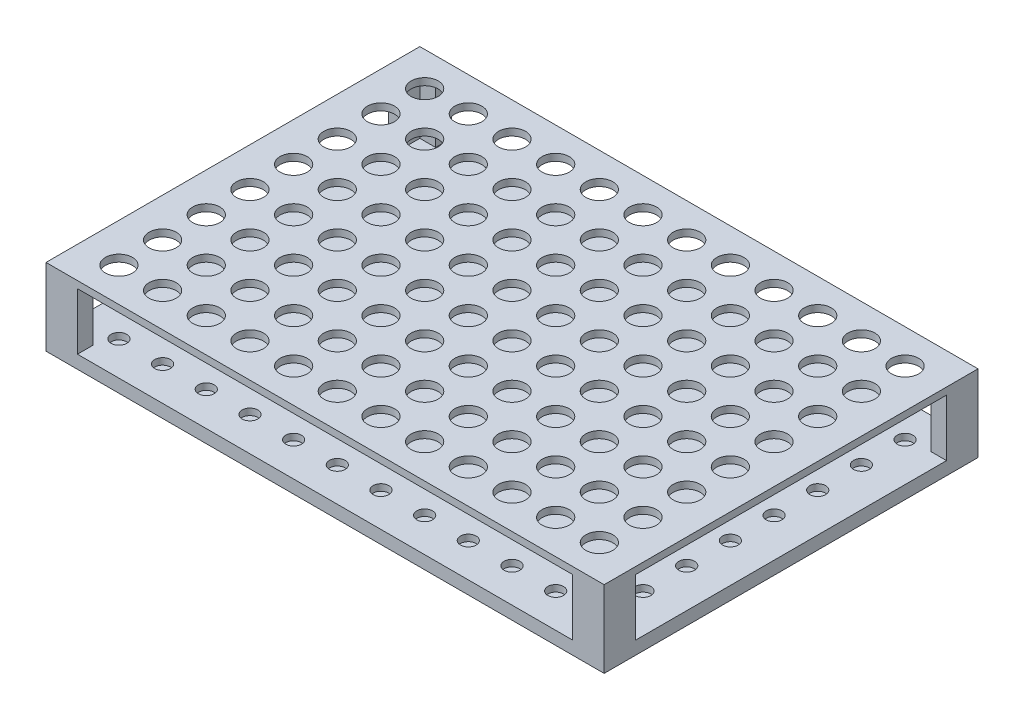
from build123d import *

# Parameters (mm, degrees)
SKETCH1_W           = 127.8
SKETCH1_H           = 85.6
BOSS_EXTRUDE1_DEPTH = 3
BOSS_EXTRUDE2_DEPTH = 13
SKETCH3_W           = 127.8
SKETCH3_H           = 85.6
BOSS_EXTRUDE3_DEPTH = 1.6
SKETCH6_R           = 3.1
CUT_EXTRUDE1_DEPTH  = 1.6
SKETCH8_R           = 1.8
CUT_EXTRUDE2_DEPTH  = 1.5


with BuildPart() as part:
    # Sketch1 → Boss-Extrude1 (new body)
    with BuildSketch(Plane(origin=(0, 0, 0), x_dir=(1, 0, 0), z_dir=(0, 1, 0))):
        Rectangle(SKETCH1_W, SKETCH1_H)
    extrude(amount=BOSS_EXTRUDE1_DEPTH)

    # Sketch2 → Boss-Extrude2 (add)
    with BuildSketch(Plane(origin=(0, 3, 0), x_dir=(1, 0, 0), z_dir=(0, 1, 0))):
        Polygon((-63.9, 42.8), (-56.7, 42.8), (-56.7, 39.2), (-60.3, 39.2), (-60.3, 35.6), (-63.9, 35.6), align=None)
        Polygon((63.9, 35.6), (63.9, 42.8), (56.7, 42.8), (56.7, 39.2), (60.3, 39.2), (60.3, 35.6), align=None)
        Polygon((63.9, -42.8), (56.7, -42.8), (56.7, -39.2), (60.3, -39.2), (60.3, -35.6), (63.9, -35.6), align=None)
        Polygon((-63.9, -35.6), (-63.9, -42.8), (-56.7, -42.8), (-56.7, -39.2), (-60.3, -39.2), (-60.3, -35.6), align=None)
    extrude(amount=BOSS_EXTRUDE2_DEPTH)

    # Sketch3 → Boss-Extrude3 (add)
    with BuildSketch(Plane(origin=(0, 16, 0), x_dir=(1, 0, 0), z_dir=(0, 1, 0))):
        Rectangle(SKETCH3_W, SKETCH3_H)
    extrude(amount=BOSS_EXTRUDE3_DEPTH)

    # Sketch6 → Cut-Extrude1 (cut)
    with BuildSketch(Plane(origin=(0, 17.6, 0), x_dir=(1, 0, 0), z_dir=(0, 1, 0))):
        with Locations(Location((-55, 35, 0), (0, 0, 270))):
            Circle(SKETCH6_R)
        with Locations(Location((-45, 35, 0), (0, 0, 270))):
            Circle(SKETCH6_R)
        with Locations(Location((-35, 35, 0), (0, 0, 270))):
            Circle(SKETCH6_R)
        with Locations(Location((-25, 35, 0), (0, 0, 270))):
            Circle(SKETCH6_R)
        with Locations(Location((-15, 35, 0), (0, 0, 270))):
            Circle(SKETCH6_R)
        with Locations(Location((-5, 35, 0), (0, 0, 270))):
            Circle(SKETCH6_R)
        with Locations(Location((5, 35, 0), (0, 0, 270))):
            Circle(SKETCH6_R)
        with Locations(Location((15, 35, 0), (0, 0, 270))):
            Circle(SKETCH6_R)
        with Locations(Location((25, 35, 0), (0, 0, 270))):
            Circle(SKETCH6_R)
        with Locations(Location((35, 35, 0), (0, 0, 270))):
            Circle(SKETCH6_R)
        with Locations(Location((45, 35, 0), (0, 0, 270))):
            Circle(SKETCH6_R)
        with Locations(Location((55, 35, 0), (0, 0, 270))):
            Circle(SKETCH6_R)
        with Locations(Location((-55, 25, 0), (0, 0, 270))):
            Circle(SKETCH6_R)
        with Locations(Location((-55, 15, 0), (0, 0, 270))):
            Circle(SKETCH6_R)
        with Locations(Location((-55, 5, 0), (0, 0, 270))):
            Circle(SKETCH6_R)
        with Locations(Location((-55, -5, 0), (0, 0, 270))):
            Circle(SKETCH6_R)
        with Locations(Location((-55, -15, 0), (0, 0, 270))):
            Circle(SKETCH6_R)
        with Locations(Location((-55, -25, 0), (0, 0, 270))):
            Circle(SKETCH6_R)
        with Locations(Location((-55, -35, 0), (0, 0, 270))):
            Circle(SKETCH6_R)
        with Locations(Location((-45, 25, 0), (0, 0, 270))):
            Circle(SKETCH6_R)
        with Locations(Location((-45, 15, 0), (0, 0, 270))):
            Circle(SKETCH6_R)
        with Locations(Location((-45, 5, 0), (0, 0, 270))):
            Circle(SKETCH6_R)
        with Locations(Location((-45, -5, 0), (0, 0, 270))):
            Circle(SKETCH6_R)
        with Locations(Location((-45, -15, 0), (0, 0, 270))):
            Circle(SKETCH6_R)
        with Locations(Location((-45, -25, 0), (0, 0, 270))):
            Circle(SKETCH6_R)
        with Locations(Location((-45, -35, 0), (0, 0, 270))):
            Circle(SKETCH6_R)
        with Locations(Location((-35, 25, 0), (0, 0, 270))):
            Circle(SKETCH6_R)
        with Locations(Location((-35, 15, 0), (0, 0, 270))):
            Circle(SKETCH6_R)
        with Locations(Location((-35, 5, 0), (0, 0, 270))):
            Circle(SKETCH6_R)
        with Locations(Location((-35, -5, 0), (0, 0, 270))):
            Circle(SKETCH6_R)
        with Locations(Location((-35, -15, 0), (0, 0, 270))):
            Circle(SKETCH6_R)
        with Locations(Location((-35, -25, 0), (0, 0, 270))):
            Circle(SKETCH6_R)
        with Locations(Location((-35, -35, 0), (0, 0, 270))):
            Circle(SKETCH6_R)
        with Locations(Location((-25, 25, 0), (0, 0, 270))):
            Circle(SKETCH6_R)
        with Locations(Location((-25, 15, 0), (0, 0, 270))):
            Circle(SKETCH6_R)
        with Locations(Location((-25, 5, 0), (0, 0, 270))):
            Circle(SKETCH6_R)
        with Locations(Location((-25, -5, 0), (0, 0, 270))):
            Circle(SKETCH6_R)
        with Locations(Location((-25, -15, 0), (0, 0, 270))):
            Circle(SKETCH6_R)
        with Locations(Location((-25, -25, 0), (0, 0, 270))):
            Circle(SKETCH6_R)
        with Locations(Location((-25, -35, 0), (0, 0, 270))):
            Circle(SKETCH6_R)
        with Locations(Location((-15, 25, 0), (0, 0, 270))):
            Circle(SKETCH6_R)
        with Locations(Location((-15, 15, 0), (0, 0, 270))):
            Circle(SKETCH6_R)
        with Locations(Location((-15, 5, 0), (0, 0, 270))):
            Circle(SKETCH6_R)
        with Locations(Location((-15, -5, 0), (0, 0, 270))):
            Circle(SKETCH6_R)
        with Locations(Location((-15, -15, 0), (0, 0, 270))):
            Circle(SKETCH6_R)
        with Locations(Location((-15, -25, 0), (0, 0, 270))):
            Circle(SKETCH6_R)
        with Locations(Location((-15, -35, 0), (0, 0, 270))):
            Circle(SKETCH6_R)
        with Locations(Location((-5, 25, 0), (0, 0, 270))):
            Circle(SKETCH6_R)
        with Locations(Location((-5, 15, 0), (0, 0, 270))):
            Circle(SKETCH6_R)
        with Locations(Location((-5, 5, 0), (0, 0, 270))):
            Circle(SKETCH6_R)
        with Locations(Location((-5, -5, 0), (0, 0, 270))):
            Circle(SKETCH6_R)
        with Locations(Location((-5, -15, 0), (0, 0, 270))):
            Circle(SKETCH6_R)
        with Locations(Location((-5, -25, 0), (0, 0, 270))):
            Circle(SKETCH6_R)
        with Locations(Location((-5, -35, 0), (0, 0, 270))):
            Circle(SKETCH6_R)
        with Locations(Location((5, 25, 0), (0, 0, 270))):
            Circle(SKETCH6_R)
        with Locations(Location((5, 15, 0), (0, 0, 270))):
            Circle(SKETCH6_R)
        with Locations(Location((5, 5, 0), (0, 0, 270))):
            Circle(SKETCH6_R)
        with Locations(Location((5, -5, 0), (0, 0, 270))):
            Circle(SKETCH6_R)
        with Locations(Location((5, -15, 0), (0, 0, 270))):
            Circle(SKETCH6_R)
        with Locations(Location((5, -25, 0), (0, 0, 270))):
            Circle(SKETCH6_R)
        with Locations(Location((5, -35, 0), (0, 0, 270))):
            Circle(SKETCH6_R)
        with Locations(Location((15, 25, 0), (0, 0, 270))):
            Circle(SKETCH6_R)
        with Locations(Location((15, 15, 0), (0, 0, 270))):
            Circle(SKETCH6_R)
        with Locations(Location((15, 5, 0), (0, 0, 270))):
            Circle(SKETCH6_R)
        with Locations(Location((15, -5, 0), (0, 0, 270))):
            Circle(SKETCH6_R)
        with Locations(Location((15, -15, 0), (0, 0, 270))):
            Circle(SKETCH6_R)
        with Locations(Location((15, -25, 0), (0, 0, 270))):
            Circle(SKETCH6_R)
        with Locations(Location((15, -35, 0), (0, 0, 270))):
            Circle(SKETCH6_R)
        with Locations(Location((25, 25, 0), (0, 0, 270))):
            Circle(SKETCH6_R)
        with Locations(Location((25, 15, 0), (0, 0, 270))):
            Circle(SKETCH6_R)
        with Locations(Location((25, 5, 0), (0, 0, 270))):
            Circle(SKETCH6_R)
        with Locations(Location((25, -5, 0), (0, 0, 270))):
            Circle(SKETCH6_R)
        with Locations(Location((25, -15, 0), (0, 0, 270))):
            Circle(SKETCH6_R)
        with Locations(Location((25, -25, 0), (0, 0, 270))):
            Circle(SKETCH6_R)
        with Locations(Location((25, -35, 0), (0, 0, 270))):
            Circle(SKETCH6_R)
        with Locations(Location((35, 25, 0), (0, 0, 270))):
            Circle(SKETCH6_R)
        with Locations(Location((35, 15, 0), (0, 0, 270))):
            Circle(SKETCH6_R)
        with Locations(Location((35, 5, 0), (0, 0, 270))):
            Circle(SKETCH6_R)
        with Locations(Location((35, -5, 0), (0, 0, 270))):
            Circle(SKETCH6_R)
        with Locations(Location((35, -15, 0), (0, 0, 270))):
            Circle(SKETCH6_R)
        with Locations(Location((35, -25, 0), (0, 0, 270))):
            Circle(SKETCH6_R)
        with Locations(Location((35, -35, 0), (0, 0, 270))):
            Circle(SKETCH6_R)
        with Locations(Location((45, 25, 0), (0, 0, 270))):
            Circle(SKETCH6_R)
        with Locations(Location((45, 15, 0), (0, 0, 270))):
            Circle(SKETCH6_R)
        with Locations(Location((45, 5, 0), (0, 0, 270))):
            Circle(SKETCH6_R)
        with Locations(Location((45, -5, 0), (0, 0, 270))):
            Circle(SKETCH6_R)
        with Locations(Location((45, -15, 0), (0, 0, 270))):
            Circle(SKETCH6_R)
        with Locations(Location((45, -25, 0), (0, 0, 270))):
            Circle(SKETCH6_R)
        with Locations(Location((45, -35, 0), (0, 0, 270))):
            Circle(SKETCH6_R)
        with Locations(Location((55, 25, 0), (0, 0, 270))):
            Circle(SKETCH6_R)
        with Locations(Location((55, 15, 0), (0, 0, 270))):
            Circle(SKETCH6_R)
        with Locations(Location((55, 5, 0), (0, 0, 270))):
            Circle(SKETCH6_R)
        with Locations(Location((55, -5, 0), (0, 0, 270))):
            Circle(SKETCH6_R)
        with Locations(Location((55, -15, 0), (0, 0, 270))):
            Circle(SKETCH6_R)
        with Locations(Location((55, -25, 0), (0, 0, 270))):
            Circle(SKETCH6_R)
        with Locations(Location((55, -35, 0), (0, 0, 270))):
            Circle(SKETCH6_R)
    extrude(amount=-CUT_EXTRUDE1_DEPTH, mode=Mode.SUBTRACT)

    # Sketch8 → Cut-Extrude2 (cut)
    with BuildSketch(Plane(origin=(0, 3, 0), x_dir=(1, 0, 0), z_dir=(0, 1, 0))):
        with Locations(Location((-55, 35, 0), (0, 0, 270))):
            Circle(SKETCH8_R)
        with Locations(Location((-45, 35, 0), (0, 0, 270))):
            Circle(SKETCH8_R)
        with Locations(Location((-35, 35, 0), (0, 0, 270))):
            Circle(SKETCH8_R)
        with Locations(Location((-25, 35, 0), (0, 0, 270))):
            Circle(SKETCH8_R)
        with Locations(Location((-15, 35, 0), (0, 0, 270))):
            Circle(SKETCH8_R)
        with Locations(Location((-5, 35, 0), (0, 0, 270))):
            Circle(SKETCH8_R)
        with Locations(Location((5, 35, 0), (0, 0, 270))):
            Circle(SKETCH8_R)
        with Locations(Location((15, 35, 0), (0, 0, 270))):
            Circle(SKETCH8_R)
        with Locations(Location((25, 35, 0), (0, 0, 270))):
            Circle(SKETCH8_R)
        with Locations(Location((35, 35, 0), (0, 0, 270))):
            Circle(SKETCH8_R)
        with Locations(Location((45, 35, 0), (0, 0, 270))):
            Circle(SKETCH8_R)
        with Locations(Location((55, 35, 0), (0, 0, 270))):
            Circle(SKETCH8_R)
        with Locations(Location((-55, 25, 0), (0, 0, 270))):
            Circle(SKETCH8_R)
        with Locations(Location((-55, 15, 0), (0, 0, 270))):
            Circle(SKETCH8_R)
        with Locations(Location((-55, 5, 0), (0, 0, 270))):
            Circle(SKETCH8_R)
        with Locations(Location((-55, -5, 0), (0, 0, 270))):
            Circle(SKETCH8_R)
        with Locations(Location((-55, -15, 0), (0, 0, 270))):
            Circle(SKETCH8_R)
        with Locations(Location((-55, -25, 0), (0, 0, 270))):
            Circle(SKETCH8_R)
        with Locations(Location((-55, -35, 0), (0, 0, 270))):
            Circle(SKETCH8_R)
        with Locations(Location((-45, 25, 0), (0, 0, 270))):
            Circle(SKETCH8_R)
        with Locations(Location((-45, 15, 0), (0, 0, 270))):
            Circle(SKETCH8_R)
        with Locations(Location((-45, 5, 0), (0, 0, 270))):
            Circle(SKETCH8_R)
        with Locations(Location((-45, -5, 0), (0, 0, 270))):
            Circle(SKETCH8_R)
        with Locations(Location((-45, -15, 0), (0, 0, 270))):
            Circle(SKETCH8_R)
        with Locations(Location((-45, -25, 0), (0, 0, 270))):
            Circle(SKETCH8_R)
        with Locations(Location((-45, -35, 0), (0, 0, 270))):
            Circle(SKETCH8_R)
        with Locations(Location((-35, 25, 0), (0, 0, 270))):
            Circle(SKETCH8_R)
        with Locations(Location((-35, 15, 0), (0, 0, 270))):
            Circle(SKETCH8_R)
        with Locations(Location((-35, 5, 0), (0, 0, 270))):
            Circle(SKETCH8_R)
        with Locations(Location((-35, -5, 0), (0, 0, 270))):
            Circle(SKETCH8_R)
        with Locations(Location((-35, -15, 0), (0, 0, 270))):
            Circle(SKETCH8_R)
        with Locations(Location((-35, -25, 0), (0, 0, 270))):
            Circle(SKETCH8_R)
        with Locations(Location((-35, -35, 0), (0, 0, 270))):
            Circle(SKETCH8_R)
        with Locations(Location((-25, 25, 0), (0, 0, 270))):
            Circle(SKETCH8_R)
        with Locations(Location((-25, 15, 0), (0, 0, 270))):
            Circle(SKETCH8_R)
        with Locations(Location((-25, 5, 0), (0, 0, 270))):
            Circle(SKETCH8_R)
        with Locations(Location((-25, -5, 0), (0, 0, 270))):
            Circle(SKETCH8_R)
        with Locations(Location((-25, -15, 0), (0, 0, 270))):
            Circle(SKETCH8_R)
        with Locations(Location((-25, -25, 0), (0, 0, 270))):
            Circle(SKETCH8_R)
        with Locations(Location((-25, -35, 0), (0, 0, 270))):
            Circle(SKETCH8_R)
        with Locations(Location((-15, 25, 0), (0, 0, 270))):
            Circle(SKETCH8_R)
        with Locations(Location((-15, 15, 0), (0, 0, 270))):
            Circle(SKETCH8_R)
        with Locations(Location((-15, 5, 0), (0, 0, 270))):
            Circle(SKETCH8_R)
        with Locations(Location((-15, -5, 0), (0, 0, 270))):
            Circle(SKETCH8_R)
        with Locations(Location((-15, -15, 0), (0, 0, 270))):
            Circle(SKETCH8_R)
        with Locations(Location((-15, -25, 0), (0, 0, 270))):
            Circle(SKETCH8_R)
        with Locations(Location((-15, -35, 0), (0, 0, 270))):
            Circle(SKETCH8_R)
        with Locations(Location((-5, 25, 0), (0, 0, 270))):
            Circle(SKETCH8_R)
        with Locations(Location((-5, 15, 0), (0, 0, 270))):
            Circle(SKETCH8_R)
        with Locations(Location((-5, 5, 0), (0, 0, 270))):
            Circle(SKETCH8_R)
        with Locations(Location((-5, -5, 0), (0, 0, 270))):
            Circle(SKETCH8_R)
        with Locations(Location((-5, -15, 0), (0, 0, 270))):
            Circle(SKETCH8_R)
        with Locations(Location((-5, -25, 0), (0, 0, 270))):
            Circle(SKETCH8_R)
        with Locations(Location((-5, -35, 0), (0, 0, 270))):
            Circle(SKETCH8_R)
        with Locations(Location((5, 25, 0), (0, 0, 270))):
            Circle(SKETCH8_R)
        with Locations(Location((5, 15, 0), (0, 0, 270))):
            Circle(SKETCH8_R)
        with Locations(Location((5, 5, 0), (0, 0, 270))):
            Circle(SKETCH8_R)
        with Locations(Location((5, -5, 0), (0, 0, 270))):
            Circle(SKETCH8_R)
        with Locations(Location((5, -15, 0), (0, 0, 270))):
            Circle(SKETCH8_R)
        with Locations(Location((5, -25, 0), (0, 0, 270))):
            Circle(SKETCH8_R)
        with Locations(Location((5, -35, 0), (0, 0, 270))):
            Circle(SKETCH8_R)
        with Locations(Location((15, 25, 0), (0, 0, 270))):
            Circle(SKETCH8_R)
        with Locations(Location((15, 15, 0), (0, 0, 270))):
            Circle(SKETCH8_R)
        with Locations(Location((15, 5, 0), (0, 0, 270))):
            Circle(SKETCH8_R)
        with Locations(Location((15, -5, 0), (0, 0, 270))):
            Circle(SKETCH8_R)
        with Locations(Location((15, -15, 0), (0, 0, 270))):
            Circle(SKETCH8_R)
        with Locations(Location((15, -25, 0), (0, 0, 270))):
            Circle(SKETCH8_R)
        with Locations(Location((15, -35, 0), (0, 0, 270))):
            Circle(SKETCH8_R)
        with Locations(Location((25, 25, 0), (0, 0, 270))):
            Circle(SKETCH8_R)
        with Locations(Location((25, 15, 0), (0, 0, 270))):
            Circle(SKETCH8_R)
        with Locations(Location((25, 5, 0), (0, 0, 270))):
            Circle(SKETCH8_R)
        with Locations(Location((25, -5, 0), (0, 0, 270))):
            Circle(SKETCH8_R)
        with Locations(Location((25, -15, 0), (0, 0, 270))):
            Circle(SKETCH8_R)
        with Locations(Location((25, -25, 0), (0, 0, 270))):
            Circle(SKETCH8_R)
        with Locations(Location((25, -35, 0), (0, 0, 270))):
            Circle(SKETCH8_R)
        with Locations(Location((35, 25, 0), (0, 0, 270))):
            Circle(SKETCH8_R)
        with Locations(Location((35, 15, 0), (0, 0, 270))):
            Circle(SKETCH8_R)
        with Locations(Location((35, 5, 0), (0, 0, 270))):
            Circle(SKETCH8_R)
        with Locations(Location((35, -5, 0), (0, 0, 270))):
            Circle(SKETCH8_R)
        with Locations(Location((35, -15, 0), (0, 0, 270))):
            Circle(SKETCH8_R)
        with Locations(Location((35, -25, 0), (0, 0, 270))):
            Circle(SKETCH8_R)
        with Locations(Location((35, -35, 0), (0, 0, 270))):
            Circle(SKETCH8_R)
        with Locations(Location((45, 25, 0), (0, 0, 270))):
            Circle(SKETCH8_R)
        with Locations(Location((45, 15, 0), (0, 0, 270))):
            Circle(SKETCH8_R)
        with Locations(Location((45, 5, 0), (0, 0, 270))):
            Circle(SKETCH8_R)
        with Locations(Location((45, -5, 0), (0, 0, 270))):
            Circle(SKETCH8_R)
        with Locations(Location((45, -15, 0), (0, 0, 270))):
            Circle(SKETCH8_R)
        with Locations(Location((45, -25, 0), (0, 0, 270))):
            Circle(SKETCH8_R)
        with Locations(Location((45, -35, 0), (0, 0, 270))):
            Circle(SKETCH8_R)
        with Locations(Location((55, 25, 0), (0, 0, 270))):
            Circle(SKETCH8_R)
        with Locations(Location((55, 15, 0), (0, 0, 270))):
            Circle(SKETCH8_R)
        with Locations(Location((55, 5, 0), (0, 0, 270))):
            Circle(SKETCH8_R)
        with Locations(Location((55, -5, 0), (0, 0, 270))):
            Circle(SKETCH8_R)
        with Locations(Location((55, -15, 0), (0, 0, 270))):
            Circle(SKETCH8_R)
        with Locations(Location((55, -25, 0), (0, 0, 270))):
            Circle(SKETCH8_R)
        with Locations(Location((55, -35, 0), (0, 0, 270))):
            Circle(SKETCH8_R)
    extrude(amount=-CUT_EXTRUDE2_DEPTH, mode=Mode.SUBTRACT)


solid = part.part
